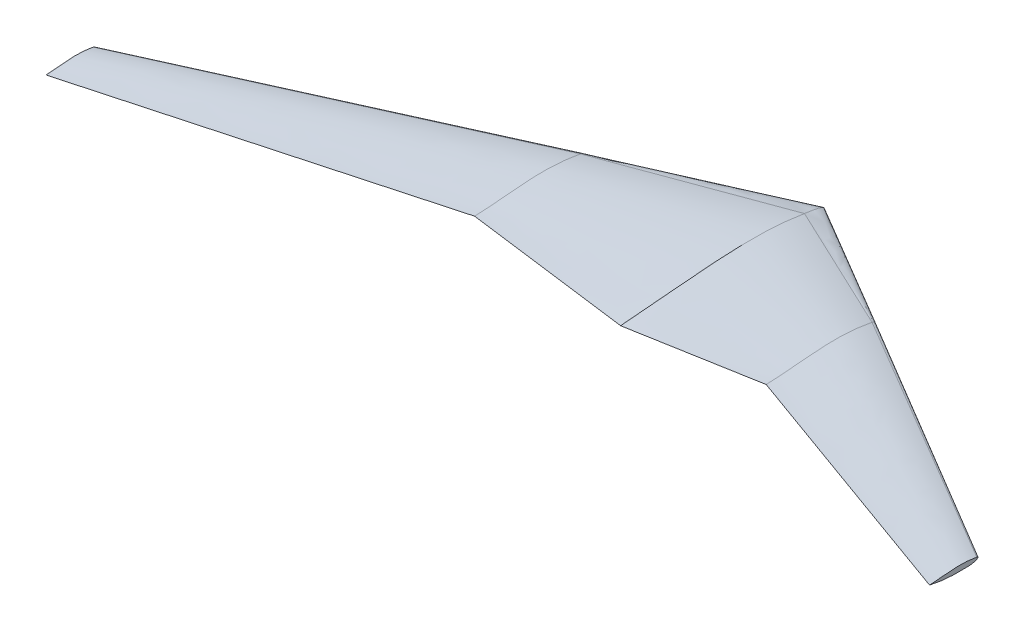
from build123d import *


with BuildPart() as part:
    # Sketch13 → Loft6 section 0
    with BuildSketch(Plane(origin=(0, 0, 0), x_dir=(0, 0, -1), z_dir=(1, 0, 0))):
        with BuildLine():
            add(Edge.make_bspline(
                [(1731.481992337, 0), (1706.220204494, 59.368252083), (1618.650124958, 85.276765455), (1483.366103783, 135.060922072), (1201.063518939, 200.98549817), (941.669375822, 217.676560238), (744.733559914, 260.387336811)],
                knots=[0, 0, 0, 0, 0.167605808, 0.249459327, 0.419761377, 1, 1, 1, 1], degree=3))
            add(Edge.make_bspline(
                [(-8454.546526407, 0), (-7986.029658749, 52.011660721), (-7099.734851668, 115.163493138), (-4039.08522406, 388.883028171), (-1425.042767402, 627.223575333), (744.733559914, 260.387336811)],
                knots=[0, 0, 0, 0, 0.153299518, 0.288860938, 1, 1, 1, 1], degree=3))
            add(Edge.make_bspline(
                [(-8454.546526407, 0), (-6774.794448789, -408.148490453), (-4110.010425407, -644.898134091), (-1115.385153468, -719.990329528), (449.105010635, -593.873292516), (1234.250758352, -422.47750346), (1666.027991532, -173.254447714), (1731.481992337, 0)],
                knots=[0, 0, 0, 0, 0.497937707, 0.767789003, 0.863745413, 0.949168367, 1, 1, 1, 1], degree=3))
        make_face()
    # Sketch14 → Loft6 section 1
    with BuildSketch(Plane(origin=(-7292.34, 0, 0), x_dir=(0, 0, -1), z_dir=(1, 0, 0))):
        with BuildLine():
            add(Edge.make_bspline(
                [(-8461.917241502, 1103.03602541), (-8037.162924838, 1108.004815157), (-7345.990137406, 1178.916691529), (-6321.62005709, 1265.784297019), (-4978.676038846, 1368.394611091), (-3895.104344257, 1297.41079666), (-3166.45384114, 1153.173283241)],
                knots=[0, 0, 0, 0, 0.239530427, 0.392189577, 0.58053955, 1, 1, 1, 1], degree=3))
            add(Edge.make_bspline(
                [(-3166.45384114, 1153.173283241), (-3070.717905723, 1148.922910019), (-3018.470929597, 1076.190066203)],
                knots=[0, 0, 0, 1, 1, 1], degree=2))
            add(Edge.make_bspline(
                [(-3018.470929597, 1076.190066203), (-3043.11370786, 1015.357370525), (-3142.59666317, 939.946125577), (-3383.503535594, 833.326910748), (-3706.783214469, 769.809843595), (-4160.911652073, 728.610370403), (-5749.386892825, 685.958224544), (-7214.685344302, 800.926845986), (-8461.917241502, 1103.03602541)],
                knots=[0, 0, 0, 0, 0.034835992, 0.06380216, 0.142864047, 0.210368093, 0.310372826, 1, 1, 1, 1], degree=3))
        make_face()
    loft()

    # Sketch12 → section 1 of loft7
    with BuildSketch(Plane(origin=(-22098, 0, 0), x_dir=(0, 0, -1), z_dir=(1, 0, 0)), mode=Mode.PRIVATE) as loft7_s1:
        with BuildLine():
            add(Edge.make_bspline(
                [(-12673.15160455, 3135.582736216), (-12685.370395384, 3105.600159778), (-12754.001168296, 3047.633847741), (-12887.833185864, 3010.015595563), (-13092.644812037, 2976.241927262), (-13834.688208071, 2959.927090239), (-14516.450731421, 2991.956060439), (-15097.226393822, 3135.582736216)],
                knots=[0, 0, 0, 0, 0.038800827, 0.103252093, 0.166674802, 0.290386765, 1, 1, 1, 1], degree=3))
            add(Edge.make_bspline(
                [(-15097.226393822, 3135.582736216), (-14661.957981708, 3150.961757758), (-13877.109803846, 3278.998461809), (-13081.80567019, 3231.524154104), (-12732.499646248, 3162.93100812)],
                knots=[0, 0, 0, 0, 0.55065911, 1, 1, 1, 1], degree=3))
            add(Edge.make_bspline(
                [(-12732.499646248, 3162.93100812), (-12710.78312966, 3158.475139061), (-12691.000449094, 3149.359048426), (-12673.15160455, 3135.582736216)],
                knots=[0, 0, 0, 0, 1, 1, 1, 1], degree=3))
        make_face()
    # loft from a face of the part (loft7)
    loft([part.faces().sort_by_distance((-7292.34, 1020.91354002, 5379.218498956))[0], loft7_s1.sketch])

    # Mirror6: part across plane


with BuildPart() as part_1:
    add(part.part)
    add(part.part.mirror(Plane(origin=(0, 0, 0), x_dir=(0, 0, 1), z_dir=(1, 0, 0))))


solid = part_1.part
